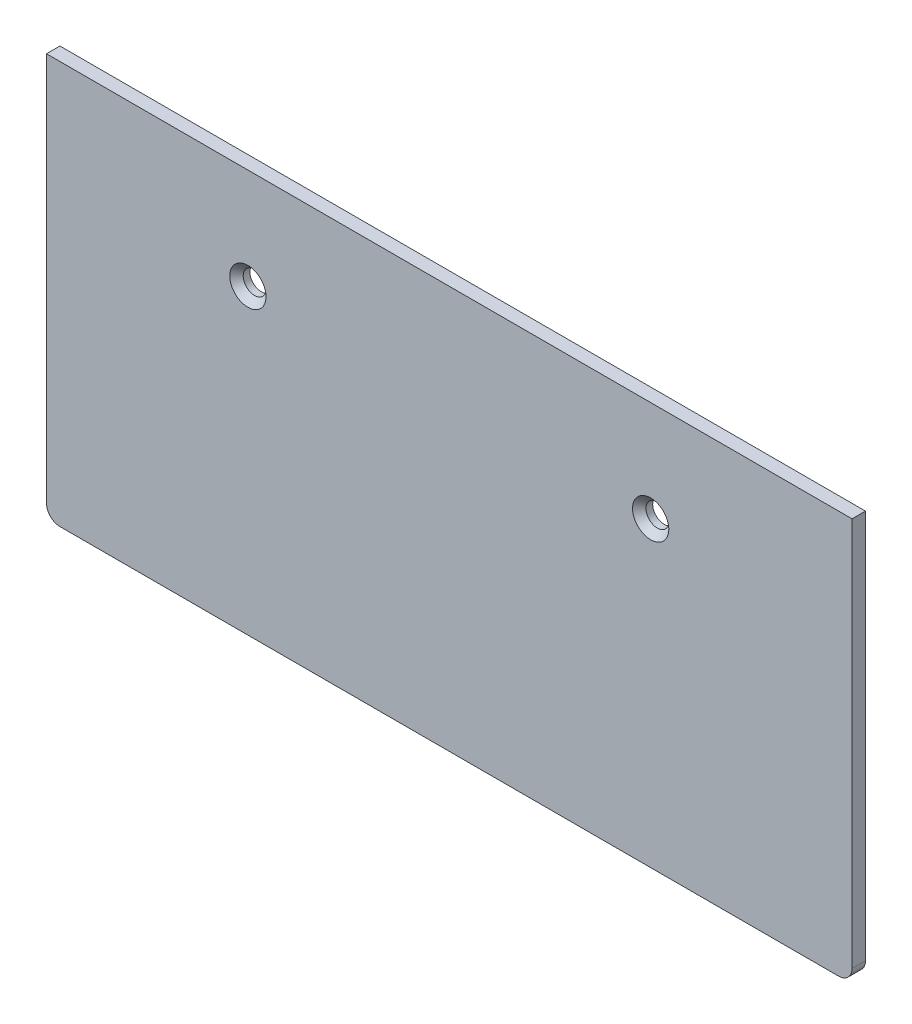
from build123d import *

# Parameters (mm, degrees)
SCHIZZO1_W                   = 120
SCHIZZO1_H                   = 60
SCHIZZO1_R                   = 1.7
ESTRUSIONE_ESTRUSIONE2_DEPTH = 2
RACCORDO1_R                  = 2
RACCORDO2_R                  = 2
SMUSSO1_SIZE                 = 1
SMUSSO2_SIZE                 = 1


with BuildPart() as part:
    # Schizzo1 → Estrusione-Estrusione2 (new body)
    with BuildSketch(Plane.XY):
        with Locations((60, 30)):
            Rectangle(SCHIZZO1_W, SCHIZZO1_H)
        with Locations((90, 45)):
            Circle(SCHIZZO1_R, mode=Mode.SUBTRACT)
        with Locations(Location((30, 45, 0), (0, 0, 180))):
            Circle(SCHIZZO1_R, mode=Mode.SUBTRACT)
    extrude(amount=-ESTRUSIONE_ESTRUSIONE2_DEPTH)

    # Raccordo1
    raccordo1_edges = [part.edges().sort_by_distance(p)[0] for p in [
        (0, 0, -1),
    ]]
    fillet(raccordo1_edges, radius=RACCORDO1_R)

    # Raccordo2
    raccordo2_edges = [part.edges().sort_by_distance(p)[0] for p in [
        (120, 0, -1),
    ]]
    fillet(raccordo2_edges, radius=RACCORDO2_R)

    # Smusso1
    smusso1_edges = [part.edges().sort_by_distance(p)[0] for p in [
        (31.7, 45, 0),
    ]]
    chamfer(smusso1_edges, length=SMUSSO1_SIZE)

    # Smusso2
    smusso2_edges = [part.edges().sort_by_distance(p)[0] for p in [
        (88.3, 45, 0),
    ]]
    chamfer(smusso2_edges, length=SMUSSO2_SIZE)


solid = part.part
